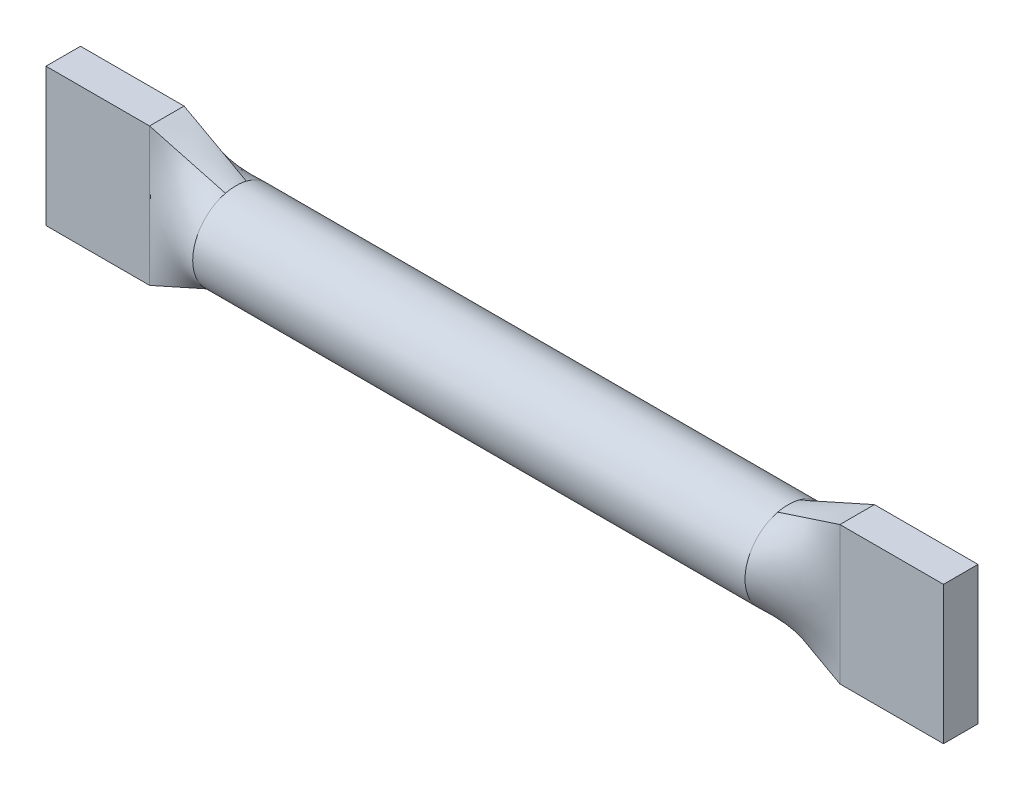
from build123d import *

# Parameters (mm, degrees)
SKETCH1_R           = 0.625
BOSS_EXTRUDE1_DEPTH = 4
SKETCH4_W           = 0.5
SKETCH4_H           = 2
BOSS_EXTRUDE2_DEPTH = 1.5


with BuildPart() as part:
    # Sketch1 → Boss-Extrude1 (new, symmetric)
    with BuildSketch(Plane(origin=(0, 0, 0), x_dir=(0, 0, -1), z_dir=(1, 0, 0))):
        Circle(SKETCH1_R)
    extrude(amount=BOSS_EXTRUDE1_DEPTH, both=True)

    # Sketch2 → Loft1 section 0
    with BuildSketch(Plane(origin=(5, 0, 0), x_dir=(0, 0, -1), z_dir=(1, 0, 0))):
        with BuildLine():
            Line((0.25, -1), (-0.25, -1))
            Line((-0.25, -1), (-0.25, 1))
            Line((-0.25, 1), (0.25, 1))
            Line((0.25, 1), (0.25, -1))
        make_face()
    # Sketch3 for Loft1 → Loft1 section 1
    with BuildSketch(Plane(origin=(4, 0, 0), x_dir=(0, 0, -1), z_dir=(1, 0, 0))):
        with BuildLine():
            # circular arc as an exact rational Bezier (weights 1, cos(half-angle), 1)
            Bezier((0.151584766, -0.606339063), (0, -0.644235254), (-0.151584766, -0.606339063), weights=[1, 0.970142502, 1])
            Bezier((-0.151584766, -0.606339063), (-2.576941004, 0), (-0.151584766, 0.606339063), weights=[1, 0.242535626, 1])
            Bezier((-0.151584766, 0.606339063), (0, 0.644235254), (0.151584766, 0.606339063), weights=[1, 0.970142502, 1])
            Bezier((0.151584766, 0.606339063), (2.576941004, 0), (0.151584766, -0.606339063), weights=[1, 0.242535626, 1])
        make_face()
    loft1 = loft()

    # Sketch4 → Boss-Extrude2 (add)
    with BuildSketch(Plane(origin=(5, 0, 0), x_dir=(0, 0, -1), z_dir=(1, 0, 0))):
        Rectangle(SKETCH4_W, SKETCH4_H)
    boss_extrude2 = extrude(amount=BOSS_EXTRUDE2_DEPTH)

    # Mirror1: Loft1, Boss-Extrude2 across plane
    add(loft1.mirror(Plane(origin=(0, 0, 0), x_dir=(0, 0, 1), z_dir=(1, 0, 0))))
    add(boss_extrude2.mirror(Plane(origin=(0, 0, 0), x_dir=(0, 0, 1), z_dir=(1, 0, 0))))


solid = part.part
